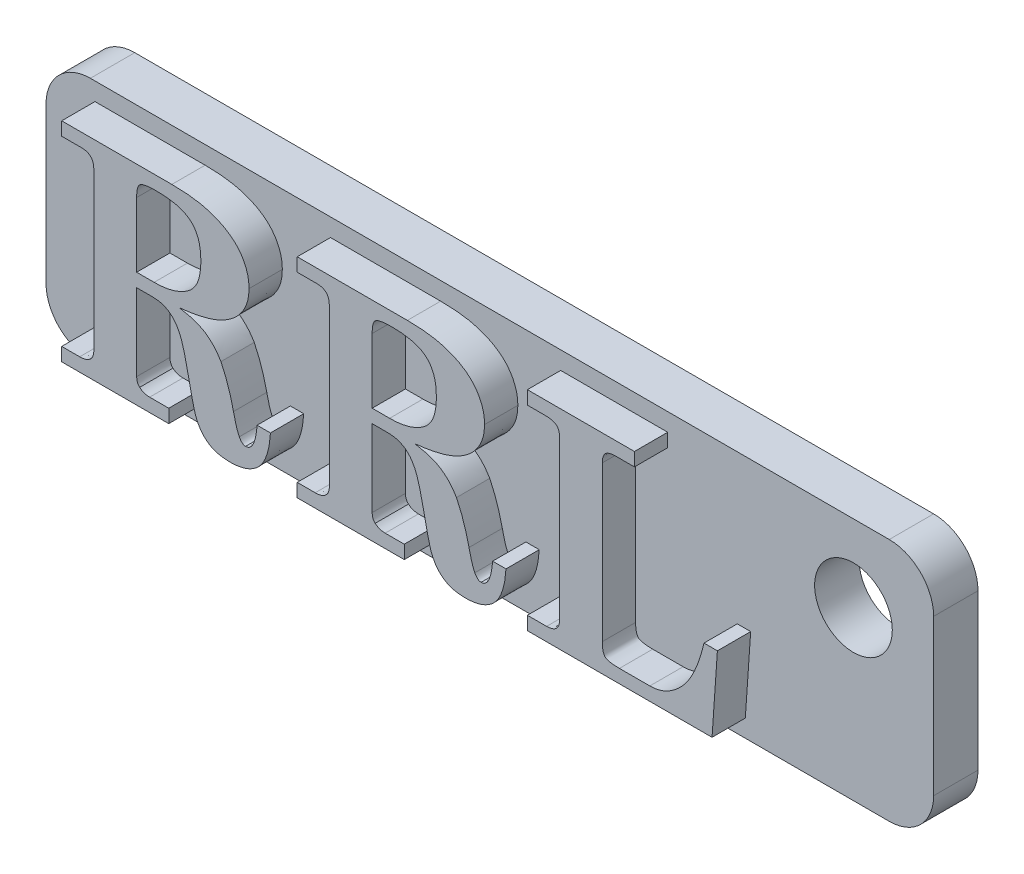
from build123d import *

# Parameters (mm, degrees)
BOSS_EXTRUDE2_DEPTH = 2
BOSS_EXTRUDE1_DEPTH = 1.5
SKETCH3_R           = 1.75
CUT_EXTRUDE1_DEPTH  = 21.838666107


with BuildPart() as part:
    # Sketch2 → Boss-Extrude2 (new body)
    with BuildSketch(Plane.XY):
        with BuildLine():
            Line((-18, 5.5), (18, 5.5))
            ThreePointArc((18, 5.5), (19.414213562, 4.914213562), (20, 3.5))
            Line((20, 3.5), (20, -3.5))
            ThreePointArc((20, -3.5), (19.414213562, -4.914213562), (18, -5.5))
            Line((18, -5.5), (-18, -5.5))
            ThreePointArc((-18, -5.5), (-19.414213562, -4.914213562), (-20, -3.5))
            Line((-20, -3.5), (-20, 3.5))
            ThreePointArc((-20, 3.5), (-19.414213562, 4.914213562), (-18, 5.5))
        make_face()
    extrude(amount=BOSS_EXTRUDE2_DEPTH)

    # Sketch1 → Boss-Extrude1 (add)
    # profile 1 of 3: a face of its own
    with BuildSketch(Plane.XY.offset(2)):
        with BuildLine():
            Line((-17.792306251, 4.694080364), (-12.828663192, 4.694080364))
            add(Edge.make_bspline(
                [(-12.828663192, 4.694080364), (-12.730035048, 4.69268479), (-12.537718263, 4.689963537), (-12.255982797, 4.677801675), (-11.988242483, 4.652805171), (-11.734140511, 4.619512844), (-11.494538517, 4.576171505), (-11.268883087, 4.524225789), (-11.058145121, 4.459104871), (-10.859253477, 4.388590104), (-10.675069792, 4.306712483), (-10.502222733, 4.220179261), (-10.341607342, 4.125844226), (-10.193150347, 4.024321409), (-10.056235222, 3.916981361), (-9.933227506, 3.801062135), (-9.821480356, 3.678346195), (-9.690024752, 3.506695514), (-9.553302789, 3.27955363), (-9.434395722, 2.988775318), (-9.362262286, 2.682490406), (-9.354091978, 2.472696616), (-9.349967259, 2.366783789)],
                knots=[0, 0, 0, 0, 1.260796864, 2.458450407, 3.603348749, 4.696868034, 5.733149247, 6.714703153, 7.654483761, 8.551049231, 9.410311666, 10.229003047, 11.020794849, 11.789116025, 12.526438116, 13.242153704, 13.946977727, 14.645554491, 16.003253973, 17.321296627, 18.647676625, 20, 20, 20, 20], degree=3))
            add(Edge.make_bspline(
                [(-9.349967259, 2.366783789), (-9.352915115, 2.282421282), (-9.358718846, 2.116328606), (-9.403198523, 1.873029201), (-9.475953273, 1.64181479), (-9.582018071, 1.42477804), (-9.714914574, 1.219244817), (-9.87845062, 1.026431585), (-10.071550114, 0.846279243), (-10.217451803, 0.741442678), (-10.292192593, 0.687738244)],
                knots=[0, 0, 0, 0, 1.006615866, 1.981822625, 2.942272039, 3.891414032, 4.85650664, 5.856958922, 6.902188287, 8, 8, 8, 8], degree=3))
            add(Edge.make_bspline(
                [(-10.292192593, 0.687738244), (-10.354945799, 0.647601368), (-10.485662323, 0.563995235), (-10.702597759, 0.458250221), (-10.943901912, 0.36445614), (-11.208356068, 0.280038352), (-11.496402328, 0.204938979), (-11.809041036, 0.141087064), (-12.145504873, 0.08850756), (-12.378782769, 0.063611491), (-12.498884325, 0.050793918)],
                knots=[0, 0, 0, 0, 0.770522959, 1.605018928, 2.492419048, 3.448517842, 4.476706657, 5.572020456, 6.749971061, 8, 8, 8, 8], degree=3))
            add(Edge.make_bspline(
                [(-12.498884325, 0.050793918), (-12.379788278, 0.029372201), (-12.154169488, -0.011209682), (-11.839892812, -0.096561194), (-11.569406343, -0.202057221), (-11.335654672, -0.326159924), (-11.131861552, -0.479353737), (-10.94464162, -0.659649319), (-10.770037989, -0.872615442), (-10.668695136, -1.031618858), (-10.616318108, -1.113796595)],
                knots=[0, 0, 0, 0, 1.260855103, 2.388598191, 3.387941535, 4.281421676, 5.137767289, 6.036055688, 6.984974634, 8, 8, 8, 8], degree=3))
            add(Edge.make_bspline(
                [(-10.616318108, -1.113796595), (-10.559190438, -1.234874713), (-10.441391144, -1.484542113), (-10.295579187, -1.886483815), (-10.159783692, -2.320469388), (-10.088014386, -2.624606811), (-10.050982907, -2.781535436)],
                knots=[0, 0, 0, 0, 0.909803941, 1.87604819, 2.904084753, 4, 4, 4, 4], degree=3))
            add(Edge.make_bspline(
                [(-10.050982907, -2.781535436), (-10.029001298, -2.877169179), (-9.988481624, -3.053455088), (-9.924242474, -3.292445708), (-9.859639057, -3.482897869), (-9.810482023, -3.590256235), (-9.789044264, -3.637076039)],
                knots=[0, 0, 0, 0, 1.313125144, 2.420541671, 3.311186147, 4, 4, 4, 4], degree=3))
            add(Edge.make_bspline(
                [(-9.789044264, -3.637076039), (-9.769192875, -3.672128074), (-9.732841944, -3.736313712), (-9.66176857, -3.80918363), (-9.587279901, -3.859395635), (-9.532786937, -3.865772765), (-9.506376664, -3.868863472)],
                knots=[0, 0, 0, 0, 1.257126063, 2.301990172, 3.177051494, 4, 4, 4, 4], degree=3))
            add(Edge.make_bspline(
                [(-9.506376664, -3.868863472), (-9.471090518, -3.8658157), (-9.400935354, -3.859756184), (-9.305037763, -3.802038031), (-9.223379598, -3.713222042), (-9.151739525, -3.591955046), (-9.095678233, -3.436215323), (-9.047053653, -3.248927256), (-9.010177751, -3.027544759), (-8.995814813, -2.868346248), (-8.98815273, -2.783419887)],
                knots=[0, 0, 0, 0, 0.646043871, 1.28445065, 2.005958554, 2.858823567, 3.864198261, 5.050731084, 6.426677019, 8, 8, 8, 8], degree=3))
            Line((-8.98815273, -2.783419887), (-8.385128517, -2.783419887))
            add(Edge.make_bspline(
                [(-8.385128517, -2.783419887), (-8.391709646, -2.872083173), (-8.404394307, -3.042975377), (-8.438233295, -3.289148077), (-8.484232419, -3.515575082), (-8.54562558, -3.722373695), (-8.615332369, -3.911461429), (-8.701288529, -4.080038315), (-8.796379344, -4.230884818), (-8.90768091, -4.359896859), (-9.029375405, -4.473007313), (-9.164636053, -4.568587237), (-9.309465515, -4.652895764), (-9.468477977, -4.718094258), (-9.637695933, -4.771926117), (-9.820037114, -4.805905929), (-10.013282191, -4.829941249), (-10.146379686, -4.832423669), (-10.214930115, -4.833702214)],
                knots=[0, 0, 0, 0, 1.367110356, 2.635008363, 3.819206984, 4.916686227, 5.950176123, 6.913653537, 7.822085834, 8.685534134, 9.526475961, 10.371017135, 11.227791915, 12.098023441, 13.008610734, 13.954046558, 14.946253751, 16, 16, 16, 16], degree=3))
            add(Edge.make_bspline(
                [(-10.214930115, -4.833702214), (-10.310640748, -4.831337975), (-10.49268334, -4.82684117), (-10.751635839, -4.778699019), (-10.981482628, -4.701243513), (-11.182465161, -4.58904447), (-11.356990463, -4.447215044), (-11.506201899, -4.274439929), (-11.636686128, -4.075325409), (-11.700818658, -3.926532392), (-11.733797354, -3.850018965)],
                knots=[0, 0, 0, 0, 1.180805118, 2.245903272, 3.239527271, 4.163314747, 5.073219269, 6.002236293, 6.972695423, 8, 8, 8, 8], degree=3))
            add(Edge.make_bspline(
                [(-11.733797354, -3.850018965), (-11.744180505, -3.823122988), (-11.767591704, -3.762479828), (-11.798442847, -3.657509107), (-11.834574551, -3.530239495), (-11.871341085, -3.37904674), (-11.913154194, -3.205137104), (-11.95829466, -3.008001793), (-12.00552331, -2.786893686), (-12.036163711, -2.631453506), (-12.052269517, -2.549748004)],
                knots=[0, 0, 0, 0, 0.51621077, 1.16391579, 1.958305469, 2.886107817, 3.950407662, 5.162257264, 6.508370262, 8, 8, 8, 8], degree=3))
            add(Edge.make_bspline(
                [(-12.052269517, -2.549748004), (-12.071551949, -2.454230549), (-12.108509821, -2.271156044), (-12.164704674, -2.008344253), (-12.220986516, -1.770313557), (-12.275638747, -1.556703362), (-12.328040241, -1.368085193), (-12.378872682, -1.204058947), (-12.426685474, -1.063753232), (-12.49106148, -0.913406195), (-12.576239168, -0.752359693), (-12.689901554, -0.582349032), (-12.821755487, -0.441595355), (-12.966708015, -0.325039593), (-13.130438065, -0.238618742), (-13.309213819, -0.172401513), (-13.507676908, -0.138303147), (-13.645149825, -0.132904883), (-13.716239456, -0.130113346)],
                knots=[0, 0, 0, 0, 1.442191922, 2.764191877, 3.977370359, 5.061944357, 6.027372746, 6.874242926, 7.603428871, 8.219893778, 9.292850582, 10.295949872, 11.236574786, 12.136774613, 13.035292675, 13.964593533, 14.947456001, 16, 16, 16, 16], degree=3))
            Line((-13.716239456, -0.130113346), (-14.415370654, -0.130113346))
            Line((-14.415370654, -0.130113346), (-14.415370654, -3.601271477))
            add(Edge.make_bspline(
                [(-14.415370654, -3.601271477), (-14.4134067, -3.637211191), (-14.409669511, -3.705600522), (-14.385749663, -3.802493755), (-14.34182003, -3.885809065), (-14.300219113, -3.929981447), (-14.279690206, -3.951779301)],
                knots=[0, 0, 0, 0, 1.11562849, 2.122918543, 3.073711999, 4, 4, 4, 4], degree=3))
            add(Edge.make_bspline(
                [(-14.279690206, -3.951779301), (-14.247270745, -3.976472533), (-14.182971728, -4.025447761), (-14.071118206, -4.073196949), (-13.953002788, -4.105539098), (-13.870991596, -4.108545199), (-13.829306496, -4.110073157)],
                knots=[0, 0, 0, 0, 1.000506897, 1.984351599, 2.975475153, 4, 4, 4, 4], degree=3))
            Line((-13.829306496, -4.110073157), (-12.968112541, -4.110073157))
            Line((-12.968112541, -4.110073157), (-12.968112541, -4.713097371))
            Line((-12.968112541, -4.713097371), (-17.792306251, -4.713097371))
            Line((-17.792306251, -4.713097371), (-17.792306251, -4.110073157))
            Line((-17.792306251, -4.110073157), (-16.981992464, -4.110073157))
            add(Edge.make_bspline(
                [(-16.981992464, -4.110073157), (-16.932836032, -4.108473008), (-16.839270557, -4.105427248), (-16.709281524, -4.077409334), (-16.596506243, -4.032215732), (-16.505623963, -3.964749465), (-16.43099492, -3.882349387), (-16.380539326, -3.782007922), (-16.3491856, -3.667849502), (-16.346470008, -3.587046176), (-16.345048138, -3.544737957)],
                knots=[0, 0, 0, 0, 1.215748592, 2.314083659, 3.276082243, 4.200108988, 5.092704252, 6.004076111, 6.954944175, 8, 8, 8, 8], degree=3))
            Line((-16.345048138, -3.544737957), (-16.345048138, 3.525720949))
            add(Edge.make_bspline(
                [(-16.345048138, 3.525720949), (-16.346843318, 3.571061482), (-16.350219459, 3.65633209), (-16.375377311, 3.776129689), (-16.422762143, 3.876234034), (-16.489371648, 3.956645948), (-16.572909876, 4.018208178), (-16.672619092, 4.061756002), (-16.788078551, 4.08532755), (-16.869449753, 4.08908104), (-16.912267789, 4.09105615)],
                knots=[0, 0, 0, 0, 1.186255313, 2.230955505, 3.179282011, 4.054730626, 4.935716216, 5.870269018, 6.87932221, 8, 8, 8, 8], degree=3))
            Line((-16.912267789, 4.09105615), (-17.792306251, 4.09105615))
            Line((-17.792306251, 4.09105615), (-17.792306251, 4.694080364))
        make_face()
        with BuildLine():
            Line((-14.415370654, 0.472910867), (-13.627670275, 0.472910867))
            add(Edge.make_bspline(
                [(-13.627670275, 0.472910867), (-13.542783745, 0.473914274), (-13.37696774, 0.475874313), (-13.135302385, 0.504077351), (-12.906873599, 0.544040665), (-12.692310795, 0.602639287), (-12.492144328, 0.678661815), (-12.303915042, 0.768130696), (-12.131467005, 0.878290888), (-12.026984384, 0.963714444), (-11.975007039, 1.006210406)],
                knots=[0, 0, 0, 0, 1.146952266, 2.240438413, 3.284842864, 4.279918954, 5.24205365, 6.176390374, 7.092802377, 8, 8, 8, 8], degree=3))
            add(Edge.make_bspline(
                [(-11.975007039, 1.006210406), (-11.938723546, 1.042306543), (-11.865054682, 1.115595005), (-11.773225791, 1.246070918), (-11.693467075, 1.391793391), (-11.629191734, 1.555820611), (-11.581496097, 1.737528157), (-11.545465861, 1.935924705), (-11.525297906, 2.152170116), (-11.52237453, 2.302043517), (-11.520854428, 2.379974943)],
                knots=[0, 0, 0, 0, 0.823637118, 1.672286907, 2.560369197, 3.496721298, 4.503762865, 5.584178681, 6.743817119, 8, 8, 8, 8], degree=3))
            add(Edge.make_bspline(
                [(-11.520854428, 2.379974943), (-11.522333404, 2.451638634), (-11.525194102, 2.590253616), (-11.546187036, 2.790577241), (-11.579453156, 2.976795688), (-11.627564746, 3.148346179), (-11.692186024, 3.304251237), (-11.770275011, 3.444960163), (-11.859922675, 3.572695345), (-11.968023791, 3.683639824), (-12.091998332, 3.780973477), (-12.236157774, 3.86459383), (-12.400137291, 3.935166974), (-12.584788387, 3.994504963), (-12.790476237, 4.035623211), (-13.015703633, 4.067440677), (-13.261040592, 4.089185423), (-13.43163789, 4.090416601), (-13.520256587, 4.09105615)],
                knots=[0, 0, 0, 0, 1.12607714, 2.178106663, 3.161725867, 4.096006619, 4.972319557, 5.807464053, 6.621093994, 7.416983527, 8.232587358, 9.090979501, 10.028176308, 11.033452721, 12.133172423, 13.319842628, 14.607761926, 16, 16, 16, 16], degree=3))
            add(Edge.make_bspline(
                [(-13.520256587, 4.09105615), (-13.567365457, 4.09065855), (-13.656596672, 4.089905436), (-13.784361509, 4.08527532), (-13.897865454, 4.072701244), (-13.998495739, 4.06183367), (-14.08405251, 4.041069502), (-14.1578209, 4.022858489), (-14.217143327, 3.995852348), (-14.281222082, 3.955181034), (-14.339453129, 3.873158922), (-14.385168622, 3.745464093), (-14.411243965, 3.579476193), (-14.413905505, 3.456082779), (-14.415370654, 3.388156051)],
                knots=[0, 0, 0, 0, 1.234073475, 2.337518953, 3.345986092, 4.225559855, 4.983998792, 5.650694609, 6.210333431, 6.684906202, 7.622862998, 8.768671454, 10.221188891, 12, 12, 12, 12], degree=3))
            Line((-14.415370654, 3.388156051), (-14.415370654, 0.472910867))
        make_face(mode=Mode.SUBTRACT)
    # profile 2 of 3: a face of its own
    with BuildSketch(Plane.XY.offset(2)):
        with BuildLine():
            Line((-7.179080089, 4.694080364), (-2.21543703, 4.694080364))
            add(Edge.make_bspline(
                [(-2.21543703, 4.694080364), (-2.116808886, 4.69268479), (-1.924492101, 4.689963537), (-1.642756635, 4.677801675), (-1.375016321, 4.652805171), (-1.120914349, 4.619512844), (-0.881312355, 4.576171505), (-0.655656926, 4.524225789), (-0.444918959, 4.459104871), (-0.246027315, 4.388590104), (-0.06184363, 4.306712483), (0.111003429, 4.220179261), (0.27161882, 4.125844226), (0.420075815, 4.024321409), (0.556990939, 3.916981361), (0.679998656, 3.801062135), (0.791745806, 3.678346195), (0.92320141, 3.506695514), (1.059923373, 3.27955363), (1.17883044, 2.988775318), (1.250963876, 2.682490406), (1.259134184, 2.472696616), (1.263258903, 2.366783789)],
                knots=[0, 0, 0, 0, 1.260796864, 2.458450407, 3.603348749, 4.696868034, 5.733149247, 6.714703153, 7.654483761, 8.551049231, 9.410311666, 10.229003047, 11.020794849, 11.789116025, 12.526438116, 13.242153704, 13.946977727, 14.645554491, 16.003253973, 17.321296627, 18.647676625, 20, 20, 20, 20], degree=3))
            add(Edge.make_bspline(
                [(1.263258903, 2.366783789), (1.260311047, 2.282421282), (1.254507316, 2.116328606), (1.210027639, 1.873029201), (1.137272889, 1.64181479), (1.031208091, 1.42477804), (0.898311588, 1.219244817), (0.734775541, 1.026431585), (0.541676048, 0.846279243), (0.395774359, 0.741442678), (0.321033569, 0.687738244)],
                knots=[0, 0, 0, 0, 1.006615866, 1.981822625, 2.942272039, 3.891414032, 4.85650664, 5.856958922, 6.902188287, 8, 8, 8, 8], degree=3))
            add(Edge.make_bspline(
                [(0.321033569, 0.687738244), (0.258280363, 0.647601368), (0.127563839, 0.563995235), (-0.089371597, 0.458250221), (-0.33067575, 0.36445614), (-0.595129906, 0.280038352), (-0.883176166, 0.204938979), (-1.195814874, 0.141087064), (-1.532278711, 0.08850756), (-1.765556607, 0.063611491), (-1.885658163, 0.050793918)],
                knots=[0, 0, 0, 0, 0.770522959, 1.605018928, 2.492419048, 3.448517842, 4.476706657, 5.572020456, 6.749971061, 8, 8, 8, 8], degree=3))
            add(Edge.make_bspline(
                [(-1.885658163, 0.050793918), (-1.766562116, 0.029372201), (-1.540943327, -0.011209682), (-1.22666665, -0.096561194), (-0.956180181, -0.202057221), (-0.722428511, -0.326159924), (-0.51863539, -0.479353737), (-0.331415458, -0.659649319), (-0.156811828, -0.872615442), (-0.055468974, -1.031618858), (-0.003091946, -1.113796595)],
                knots=[0, 0, 0, 0, 1.260855103, 2.388598191, 3.387941535, 4.281421676, 5.137767289, 6.036055688, 6.984974634, 8, 8, 8, 8], degree=3))
            add(Edge.make_bspline(
                [(-0.003091946, -1.113796595), (0.054035724, -1.234874713), (0.171835018, -1.484542113), (0.317646975, -1.886483815), (0.453442469, -2.320469388), (0.525211776, -2.624606811), (0.562243255, -2.781535436)],
                knots=[0, 0, 0, 0, 0.909803941, 1.87604819, 2.904084753, 4, 4, 4, 4], degree=3))
            add(Edge.make_bspline(
                [(0.562243255, -2.781535436), (0.584224864, -2.877169179), (0.624744537, -3.053455088), (0.688983688, -3.292445708), (0.753587105, -3.482897869), (0.802744139, -3.590256235), (0.824181898, -3.637076039)],
                knots=[0, 0, 0, 0, 1.313125144, 2.420541671, 3.311186147, 4, 4, 4, 4], degree=3))
            add(Edge.make_bspline(
                [(0.824181898, -3.637076039), (0.844033287, -3.672128074), (0.880384218, -3.736313712), (0.951457592, -3.80918363), (1.025946261, -3.859395635), (1.080439225, -3.865772765), (1.106849498, -3.868863472)],
                knots=[0, 0, 0, 0, 1.257126063, 2.301990172, 3.177051494, 4, 4, 4, 4], degree=3))
            add(Edge.make_bspline(
                [(1.106849498, -3.868863472), (1.142135644, -3.8658157), (1.212290808, -3.859756184), (1.308188399, -3.802038031), (1.389846564, -3.713222042), (1.461486637, -3.591955046), (1.517547929, -3.436215323), (1.566172509, -3.248927256), (1.603048411, -3.027544759), (1.617411349, -2.868346248), (1.625073431, -2.783419887)],
                knots=[0, 0, 0, 0, 0.646043871, 1.28445065, 2.005958554, 2.858823567, 3.864198261, 5.050731084, 6.426677019, 8, 8, 8, 8], degree=3))
            Line((1.625073431, -2.783419887), (2.228097645, -2.783419887))
            add(Edge.make_bspline(
                [(2.228097645, -2.783419887), (2.221516516, -2.872083173), (2.208831855, -3.042975377), (2.174992867, -3.289148077), (2.128993743, -3.515575082), (2.067600581, -3.722373695), (1.997893792, -3.911461429), (1.911937633, -4.080038315), (1.816846817, -4.230884818), (1.705545252, -4.359896859), (1.583850757, -4.473007313), (1.448590109, -4.568587237), (1.303760647, -4.652895764), (1.144748185, -4.718094258), (0.975530229, -4.771926117), (0.793189048, -4.805905929), (0.599943971, -4.829941249), (0.466846476, -4.832423669), (0.398296047, -4.833702214)],
                knots=[0, 0, 0, 0, 1.367110356, 2.635008363, 3.819206984, 4.916686227, 5.950176123, 6.913653537, 7.822085834, 8.685534134, 9.526475961, 10.371017135, 11.227791915, 12.098023441, 13.008610734, 13.954046558, 14.946253751, 16, 16, 16, 16], degree=3))
            add(Edge.make_bspline(
                [(0.398296047, -4.833702214), (0.302585414, -4.831337975), (0.120542822, -4.82684117), (-0.138409677, -4.778699019), (-0.368256466, -4.701243513), (-0.569238999, -4.58904447), (-0.743764302, -4.447215044), (-0.892975737, -4.274439929), (-1.023459966, -4.075325409), (-1.087592496, -3.926532392), (-1.120571192, -3.850018965)],
                knots=[0, 0, 0, 0, 1.180805118, 2.245903272, 3.239527271, 4.163314747, 5.073219269, 6.002236293, 6.972695423, 8, 8, 8, 8], degree=3))
            add(Edge.make_bspline(
                [(-1.120571192, -3.850018965), (-1.130954343, -3.823122988), (-1.154365543, -3.762479828), (-1.185216685, -3.657509107), (-1.221348389, -3.530239495), (-1.258114923, -3.37904674), (-1.299928032, -3.205137104), (-1.345068498, -3.008001793), (-1.392297149, -2.786893686), (-1.422937549, -2.631453506), (-1.439043355, -2.549748004)],
                knots=[0, 0, 0, 0, 0.51621077, 1.16391579, 1.958305469, 2.886107817, 3.950407662, 5.162257264, 6.508370262, 8, 8, 8, 8], degree=3))
            add(Edge.make_bspline(
                [(-1.439043355, -2.549748004), (-1.458325788, -2.454230549), (-1.495283659, -2.271156044), (-1.551478512, -2.008344253), (-1.607760354, -1.770313557), (-1.662412586, -1.556703362), (-1.714814079, -1.368085193), (-1.76564652, -1.204058947), (-1.813459312, -1.063753232), (-1.877835318, -0.913406195), (-1.963013006, -0.752359693), (-2.076675392, -0.582349032), (-2.208529325, -0.441595355), (-2.353481854, -0.325039593), (-2.517211903, -0.238618742), (-2.695987658, -0.172401513), (-2.894450746, -0.138303147), (-3.031923664, -0.132904883), (-3.103013294, -0.130113346)],
                knots=[0, 0, 0, 0, 1.442191922, 2.764191877, 3.977370359, 5.061944357, 6.027372746, 6.874242926, 7.603428871, 8.219893778, 9.292850582, 10.295949872, 11.236574786, 12.136774613, 13.035292675, 13.964593533, 14.947456001, 16, 16, 16, 16], degree=3))
            Line((-3.103013294, -0.130113346), (-3.802144492, -0.130113346))
            Line((-3.802144492, -0.130113346), (-3.802144492, -3.601271477))
            add(Edge.make_bspline(
                [(-3.802144492, -3.601271477), (-3.800180538, -3.637211191), (-3.796443349, -3.705600522), (-3.772523501, -3.802493755), (-3.728593868, -3.885809065), (-3.686992951, -3.929981447), (-3.666464044, -3.951779301)],
                knots=[0, 0, 0, 0, 1.11562849, 2.122918543, 3.073711999, 4, 4, 4, 4], degree=3))
            add(Edge.make_bspline(
                [(-3.666464044, -3.951779301), (-3.634044583, -3.976472533), (-3.569745566, -4.025447761), (-3.457892044, -4.073196949), (-3.339776626, -4.105539098), (-3.257765434, -4.108545199), (-3.216080335, -4.110073157)],
                knots=[0, 0, 0, 0, 1.000506897, 1.984351599, 2.975475153, 4, 4, 4, 4], degree=3))
            Line((-3.216080335, -4.110073157), (-2.354886379, -4.110073157))
            Line((-2.354886379, -4.110073157), (-2.354886379, -4.713097371))
            Line((-2.354886379, -4.713097371), (-7.179080089, -4.713097371))
            Line((-7.179080089, -4.713097371), (-7.179080089, -4.110073157))
            Line((-7.179080089, -4.110073157), (-6.368766302, -4.110073157))
            add(Edge.make_bspline(
                [(-6.368766302, -4.110073157), (-6.319609871, -4.108473008), (-6.226044395, -4.105427248), (-6.096055362, -4.077409334), (-5.983280081, -4.032215732), (-5.892397801, -3.964749465), (-5.817768759, -3.882349387), (-5.767313164, -3.782007922), (-5.735959438, -3.667849502), (-5.733243846, -3.587046176), (-5.731821976, -3.544737957)],
                knots=[0, 0, 0, 0, 1.215748592, 2.314083659, 3.276082243, 4.200108988, 5.092704252, 6.004076111, 6.954944175, 8, 8, 8, 8], degree=3))
            Line((-5.731821976, -3.544737957), (-5.731821976, 3.525720949))
            add(Edge.make_bspline(
                [(-5.731821976, 3.525720949), (-5.733617156, 3.571061482), (-5.736993297, 3.65633209), (-5.762151149, 3.776129689), (-5.809535981, 3.876234034), (-5.876145486, 3.956645948), (-5.959683715, 4.018208178), (-6.05939293, 4.061756002), (-6.174852389, 4.08532755), (-6.256223591, 4.08908104), (-6.299041627, 4.09105615)],
                knots=[0, 0, 0, 0, 1.186255313, 2.230955505, 3.179282011, 4.054730626, 4.935716216, 5.870269018, 6.87932221, 8, 8, 8, 8], degree=3))
            Line((-6.299041627, 4.09105615), (-7.179080089, 4.09105615))
            Line((-7.179080089, 4.09105615), (-7.179080089, 4.694080364))
        make_face()
        with BuildLine():
            Line((-3.802144492, 0.472910867), (-3.014444113, 0.472910867))
            add(Edge.make_bspline(
                [(-3.014444113, 0.472910867), (-2.929557583, 0.473914274), (-2.763741578, 0.475874313), (-2.522076223, 0.504077351), (-2.293647437, 0.544040665), (-2.079084634, 0.602639287), (-1.878918166, 0.678661815), (-1.69068888, 0.768130696), (-1.518240843, 0.878290888), (-1.413758222, 0.963714444), (-1.361780877, 1.006210406)],
                knots=[0, 0, 0, 0, 1.146952266, 2.240438413, 3.284842864, 4.279918954, 5.24205365, 6.176390374, 7.092802377, 8, 8, 8, 8], degree=3))
            add(Edge.make_bspline(
                [(-1.361780877, 1.006210406), (-1.325497384, 1.042306543), (-1.25182852, 1.115595005), (-1.159999629, 1.246070918), (-1.080240914, 1.391793391), (-1.015965572, 1.555820611), (-0.968269935, 1.737528157), (-0.932239699, 1.935924705), (-0.912071744, 2.152170116), (-0.909148368, 2.302043517), (-0.907628266, 2.379974943)],
                knots=[0, 0, 0, 0, 0.823637118, 1.672286907, 2.560369197, 3.496721298, 4.503762865, 5.584178681, 6.743817119, 8, 8, 8, 8], degree=3))
            add(Edge.make_bspline(
                [(-0.907628266, 2.379974943), (-0.909107242, 2.451638634), (-0.91196794, 2.590253616), (-0.932960874, 2.790577241), (-0.966226994, 2.976795688), (-1.014338584, 3.148346179), (-1.078959862, 3.304251237), (-1.157048849, 3.444960163), (-1.246696513, 3.572695345), (-1.354797629, 3.683639824), (-1.47877217, 3.780973477), (-1.622931612, 3.86459383), (-1.786911129, 3.935166974), (-1.971562225, 3.994504963), (-2.177250075, 4.035623211), (-2.402477472, 4.067440677), (-2.64781443, 4.089185423), (-2.818411728, 4.090416601), (-2.907030425, 4.09105615)],
                knots=[0, 0, 0, 0, 1.12607714, 2.178106663, 3.161725867, 4.096006619, 4.972319557, 5.807464053, 6.621093994, 7.416983527, 8.232587358, 9.090979501, 10.028176308, 11.033452721, 12.133172423, 13.319842628, 14.607761926, 16, 16, 16, 16], degree=3))
            add(Edge.make_bspline(
                [(-2.907030425, 4.09105615), (-2.954139295, 4.09065855), (-3.04337051, 4.089905436), (-3.171135347, 4.08527532), (-3.284639292, 4.072701244), (-3.385269577, 4.06183367), (-3.470826349, 4.041069502), (-3.544594738, 4.022858489), (-3.603917165, 3.995852348), (-3.667995921, 3.955181034), (-3.726226967, 3.873158922), (-3.77194246, 3.745464093), (-3.798017803, 3.579476193), (-3.800679344, 3.456082779), (-3.802144492, 3.388156051)],
                knots=[0, 0, 0, 0, 1.234073475, 2.337518953, 3.345986092, 4.225559855, 4.983998792, 5.650694609, 6.210333431, 6.684906202, 7.622862998, 8.768671454, 10.221188891, 12, 12, 12, 12], degree=3))
            Line((-3.802144492, 3.388156051), (-3.802144492, 0.472910867))
        make_face(mode=Mode.SUBTRACT)
    # profile 3 of 3: a face of its own
    with BuildSketch(Plane.XY.offset(2)):
        with BuildLine():
            Line((3.192936387, 4.09105615), (3.192936387, 4.694080364))
            Line((3.192936387, 4.694080364), (8.017130097, 4.694080364))
            Line((8.017130097, 4.694080364), (8.017130097, 4.09105615))
            Line((8.017130097, 4.09105615), (7.201162958, 4.09105615))
            add(Edge.make_bspline(
                [(7.201162958, 4.09105615), (7.146973951, 4.090316088), (7.046617629, 4.088945518), (6.909040116, 4.06159252), (6.795280703, 4.022888411), (6.706358165, 3.961932334), (6.644295644, 3.879770462), (6.600242309, 3.779968207), (6.574808555, 3.659493898), (6.571591963, 3.572329539), (6.569871984, 3.525720949)],
                knots=[0, 0, 0, 0, 1.317174052, 2.439364582, 3.40274332, 4.226216974, 5.021934816, 5.877883306, 6.86526021, 8, 8, 8, 8], degree=3))
            Line((6.569871984, 3.525720949), (6.569871984, -3.450515423))
            add(Edge.make_bspline(
                [(6.569871984, -3.450515423), (6.57055665, -3.514712935), (6.57179927, -3.63122679), (6.597960919, -3.7874249), (6.636326908, -3.908278473), (6.699206161, -4.001156735), (6.805184591, -4.053332368), (6.944300643, -4.084973797), (7.127668663, -4.107310775), (7.264537266, -4.109086284), (7.340612307, -4.110073157)],
                knots=[0, 0, 0, 0, 1.253318516, 2.274682744, 3.08242206, 3.723352428, 4.399534733, 5.325689848, 6.513550565, 8, 8, 8, 8], degree=3))
            Line((7.340612307, -4.110073157), (8.710607943, -4.110073157))
            add(Edge.make_bspline(
                [(8.710607943, -4.110073157), (8.774196891, -4.107813113), (8.900916578, -4.103309309), (9.088482055, -4.069573159), (9.273409036, -4.017936482), (9.452301592, -3.937751425), (9.630968616, -3.84256209), (9.804163292, -3.722315309), (9.974756981, -3.581589291), (10.142254974, -3.420077175), (10.303664877, -3.234349785), (10.454222701, -3.021858041), (10.595476305, -2.78340579), (10.726694821, -2.519102699), (10.848746657, -2.230053554), (10.962695749, -1.915953976), (11.06291837, -1.574815479), (11.122294252, -1.337636769), (11.152856009, -1.215556931)],
                knots=[0, 0, 0, 0, 0.746952398, 1.488522408, 2.233867827, 2.997739128, 3.787258218, 4.610437708, 5.470623944, 6.384302497, 7.342016262, 8.35813022, 9.440650158, 10.596202486, 11.823439516, 13.126538548, 14.520981459, 16, 16, 16, 16], degree=3))
            Line((11.152856009, -1.215556931), (11.755880222, -1.215556931))
            Line((11.755880222, -1.215556931), (11.514670537, -4.713097371))
            Line((11.514670537, -4.713097371), (3.192936387, -4.713097371))
            Line((3.192936387, -4.713097371), (3.192936387, -4.110073157))
            Line((3.192936387, -4.110073157), (4.059783694, -4.110073157))
            add(Edge.make_bspline(
                [(4.059783694, -4.110073157), (4.104498004, -4.108245137), (4.189755831, -4.104759609), (4.308944355, -4.0794974), (4.410600275, -4.03480302), (4.495955675, -3.974554994), (4.560228104, -3.894636623), (4.609513005, -3.802464748), (4.634853636, -3.693646282), (4.638352308, -3.617085804), (4.6401945, -3.576773618)],
                knots=[0, 0, 0, 0, 1.195528741, 2.279542841, 3.234602015, 4.14844858, 5.043106676, 5.952155301, 6.921726988, 8, 8, 8, 8], degree=3))
            Line((4.6401945, -3.576773618), (4.6401945, 3.595445624))
            add(Edge.make_bspline(
                [(4.6401945, 3.595445624), (4.638609579, 3.635825536), (4.635617158, 3.712065072), (4.607648576, 3.817968758), (4.559445496, 3.906473262), (4.489940552, 3.97757991), (4.39734584, 4.031857404), (4.2783633, 4.065250351), (4.134770703, 4.087822032), (4.029745137, 4.089922987), (3.973098964, 4.09105615)],
                knots=[0, 0, 0, 0, 1.00990991, 1.906766507, 2.716615905, 3.506507968, 4.367174043, 5.37229384, 6.582730811, 8, 8, 8, 8], degree=3))
            Line((3.973098964, 4.09105615), (3.192936387, 4.09105615))
        make_face()
    extrude(amount=BOSS_EXTRUDE1_DEPTH)

    # Sketch3 → Cut-Extrude1 (cut, through all)
    with BuildSketch(Plane.XY.offset(2)):
        with Locations((16.387938716, 2.034017624)):
            Circle(SKETCH3_R)
    extrude(amount=-CUT_EXTRUDE1_DEPTH, mode=Mode.SUBTRACT)


solid = part.part
